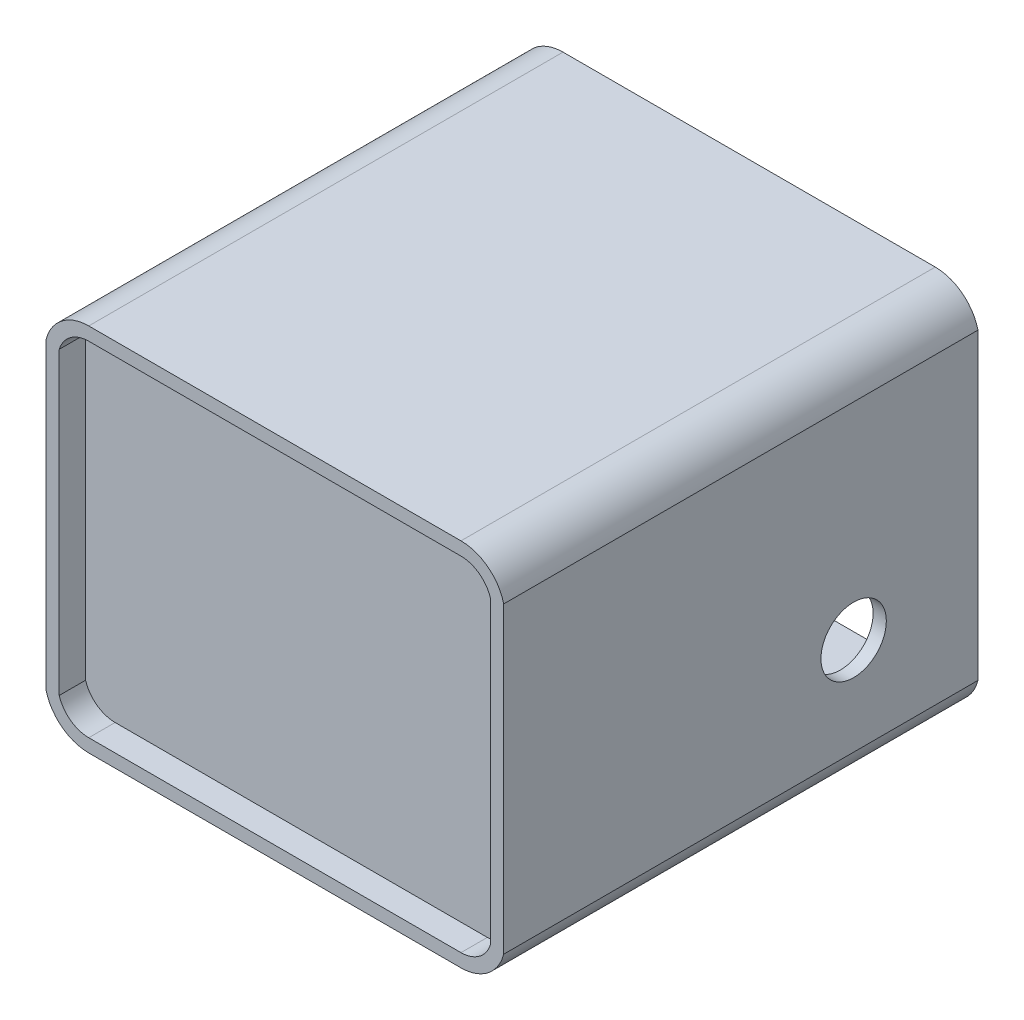
from build123d import *

# Parameters (mm, degrees)
BOSS_EXTRUDE1_DEPTH = 231.201214
BOSS_EXTRUDE2_START = -12.852654
BOSS_EXTRUDE2_DEPTH = 6.35
SKETCH3_R           = 15.942437
CUT_EXTRUDE1_DEPTH  = 842.74192987


with BuildPart() as part:
    # Sketch1 → Boss-Extrude1 (new body)
    with BuildSketch(Plane.XY):
        with BuildLine():
            Line((-90.736928, 597.708228), (90.721434, 597.708228))
            ThreePointArc((90.721434, 597.708228), (103.921108752, 602.235738137), (111.562896, 613.911904))
            Line((111.562896, 613.911904), (111.562896, 761.795784))
            ThreePointArc((111.562896, 761.795784), (103.921186704, 773.472121096), (90.721434, 777.999714))
            Line((90.721434, 777.999714), (-90.736928, 777.999714))
            ThreePointArc((-90.736928, 777.999714), (-103.936580442, 773.472111924), (-111.578136, 761.795784))
            Line((-111.578136, 761.795784), (-111.578136, 613.911904))
            ThreePointArc((-111.578136, 613.911904), (-103.936502489, 602.235747309), (-90.736928, 597.708228))
        make_face()
        with BuildLine():
            Line((-90.736928, 604.150176), (90.721434, 604.150176))
            ThreePointArc((90.721434, 604.150176), (99.673810429, 607.099124575), (105.120948, 614.791330612))
            Line((105.120948, 614.791330612), (105.120948, 760.91641141))
            ThreePointArc((105.120948, 760.91641141), (99.673869855, 768.60875328), (90.721434, 771.557766))
            Line((90.721434, 771.557766), (-90.736928, 771.557766))
            ThreePointArc((-90.736928, 771.557766), (-99.689249554, 768.60875822), (-105.136188, 760.916452346))
            Line((-105.136188, 760.916452346), (-105.136188, 614.791289676))
            ThreePointArc((-105.136188, 614.791289676), (-99.689190128, 607.099119635), (-90.736928, 604.150176))
        make_face(mode=Mode.SUBTRACT)
    extrude(amount=-BOSS_EXTRUDE1_DEPTH)

    # Sketch1<2> → Boss-Extrude2 (add)
    with BuildSketch(Plane.XY.offset(BOSS_EXTRUDE2_START)):
        with BuildLine():
            Line((90.721434, 771.557766), (-90.736928, 771.557766))
            ThreePointArc((-90.736928, 771.557766), (-99.689249554, 768.60875822), (-105.136188, 760.916452346))
            Line((-105.136188, 760.916452346), (-105.136188, 614.791289676))
            ThreePointArc((-105.136188, 614.791289676), (-99.689190128, 607.099119635), (-90.736928, 604.150176))
            Line((-90.736928, 604.150176), (90.721434, 604.150176))
            ThreePointArc((90.721434, 604.150176), (99.673810429, 607.099124575), (105.120948, 614.791330612))
            Line((105.120948, 614.791330612), (105.120948, 760.91641141))
            ThreePointArc((105.120948, 760.91641141), (99.673869855, 768.60875328), (90.721434, 771.557766))
        make_face()
    extrude(amount=-BOSS_EXTRUDE2_DEPTH)

    # Sketch3 → Cut-Extrude1 (cut, through all)
    with BuildSketch(Plane(origin=(111.562896, 0, 0), x_dir=(0, 0, -1), z_dir=(1, 0, 0))):
        with Locations((170.56862, 661.318972)):
            Circle(SKETCH3_R)
    extrude(amount=-CUT_EXTRUDE1_DEPTH, mode=Mode.SUBTRACT)


solid = part.part
